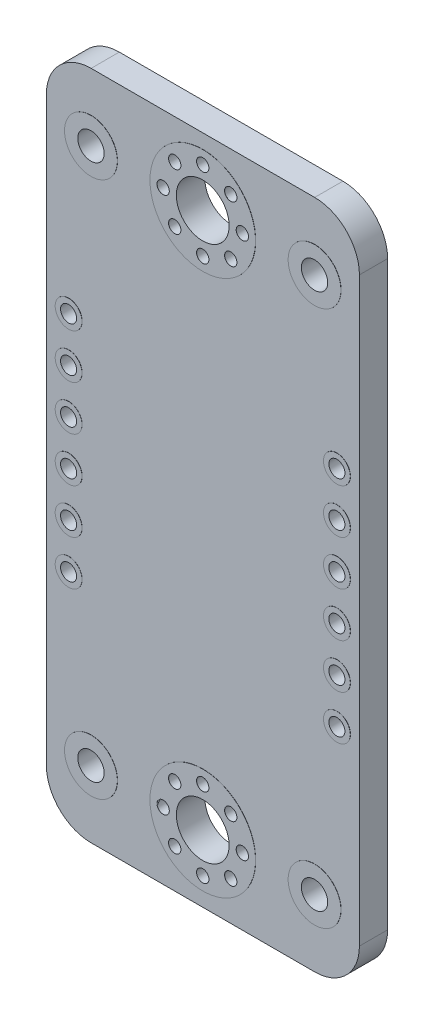
from build123d import *

# Parameters (mm, degrees)
MODEL_R             = 0.4572
MODEL_R_2           = 1.499997
MODEL_R_3           = 0.350012
MODEL_R_4           = 0.7500112
BOSS_EXTRUDE1_DEPTH = 1.6
SKETCH1_R           = 2.999994
SKETCH1_R_2         = 1.499997
SKETCH1_R_3         = 0.350012
SKETCH1_R_4         = 0.7500112
SKETCH1_R_5         = 0.762
SKETCH1_R_6         = 0.4572
BOSS_EXTRUDE2_DEPTH = 0.01
SKETCH2_W           = 1.25
SKETCH2_H           = 2
BOSS_EXTRUDE3_DEPTH = 0.3
BOSS_EXTRUDE4_START = 2.89
BOSS_EXTRUDE4_DEPTH = 1.25
LPATTERN1_COUNT     = 2
LPATTERN1_PITCH     = 10.75
LPATTERN1_2_COUNT   = 4
LPATTERN1_2_PITCH   = 6.66


with BuildPart() as part:
    # Model → Boss-Extrude1 (new body)
    with BuildSketch(Plane.XY):
        with BuildLine():
            Line((2.54, 0), (15.24, 0))
            ThreePointArc((15.24, 0), (17.036051224, -0.743948776), (17.78, -2.54))
            Line((17.78, -2.54), (17.78, -35.56))
            ThreePointArc((17.78, -35.56), (17.036051224, -37.356051224), (15.24, -38.1))
            Line((15.24, -38.1), (2.54, -38.1))
            ThreePointArc((2.54, -38.1), (0.743948776, -37.356051224), (0, -35.56))
            Line((0, -35.56), (0, -2.54))
            ThreePointArc((0, -2.54), (0.743948776, -0.743948776), (2.54, 0))
        make_face()
        with Locations((16.51, -15.24)):
            Circle(MODEL_R, mode=Mode.SUBTRACT)
        with Locations((16.51, -17.78)):
            Circle(MODEL_R, mode=Mode.SUBTRACT)
        with Locations((16.51, -20.32)):
            Circle(MODEL_R, mode=Mode.SUBTRACT)
        with Locations((16.51, -22.86)):
            Circle(MODEL_R, mode=Mode.SUBTRACT)
        with Locations((16.51, -25.4)):
            Circle(MODEL_R, mode=Mode.SUBTRACT)
        with Locations((1.27, -25.4)):
            Circle(MODEL_R, mode=Mode.SUBTRACT)
        with Locations((1.27, -22.86)):
            Circle(MODEL_R, mode=Mode.SUBTRACT)
        with Locations((1.27, -20.32)):
            Circle(MODEL_R, mode=Mode.SUBTRACT)
        with Locations((1.27, -17.78)):
            Circle(MODEL_R, mode=Mode.SUBTRACT)
        with Locations((1.27, -15.24)):
            Circle(MODEL_R, mode=Mode.SUBTRACT)
        with Locations((1.27, -12.7)):
            Circle(MODEL_R, mode=Mode.SUBTRACT)
        with Locations((8.89, -3.81)):
            Circle(MODEL_R_2, mode=Mode.SUBTRACT)
        with Locations((11.1400082, -3.81)):
            Circle(MODEL_R_3, mode=Mode.SUBTRACT)
        with Locations((6.6399918, -3.81)):
            Circle(MODEL_R_3, mode=Mode.SUBTRACT)
        with Locations((8.89, -1.560068)):
            Circle(MODEL_R_3, mode=Mode.SUBTRACT)
        with Locations((8.89, -6.059932)):
            Circle(MODEL_R_3, mode=Mode.SUBTRACT)
        with Locations((10.481056, -5.401056)):
            Circle(MODEL_R_3, mode=Mode.SUBTRACT)
        with Locations((10.481056, -2.218944)):
            Circle(MODEL_R_3, mode=Mode.SUBTRACT)
        with Locations((7.298944, -2.218944)):
            Circle(MODEL_R_3, mode=Mode.SUBTRACT)
        with Locations((7.298944, -5.401056)):
            Circle(MODEL_R_3, mode=Mode.SUBTRACT)
        with Locations((8.89, -34.29)):
            Circle(MODEL_R_2, mode=Mode.SUBTRACT)
        with Locations((11.1400082, -34.29)):
            Circle(MODEL_R_3, mode=Mode.SUBTRACT)
        with Locations((6.6399918, -34.29)):
            Circle(MODEL_R_3, mode=Mode.SUBTRACT)
        with Locations((8.89, -32.040068)):
            Circle(MODEL_R_3, mode=Mode.SUBTRACT)
        with Locations((8.89, -36.539932)):
            Circle(MODEL_R_3, mode=Mode.SUBTRACT)
        with Locations((10.481056, -35.881056)):
            Circle(MODEL_R_3, mode=Mode.SUBTRACT)
        with Locations((10.481056, -32.698944)):
            Circle(MODEL_R_3, mode=Mode.SUBTRACT)
        with Locations((7.298944, -32.698944)):
            Circle(MODEL_R_3, mode=Mode.SUBTRACT)
        with Locations((7.298944, -35.881056)):
            Circle(MODEL_R_3, mode=Mode.SUBTRACT)
        with Locations((2.54, -3.81)):
            Circle(MODEL_R_4, mode=Mode.SUBTRACT)
        with Locations((15.24, -3.81)):
            Circle(MODEL_R_4, mode=Mode.SUBTRACT)
        with Locations((15.24, -34.29)):
            Circle(MODEL_R_4, mode=Mode.SUBTRACT)
        with Locations((2.54, -34.29)):
            Circle(MODEL_R_4, mode=Mode.SUBTRACT)
        with Locations((16.51, -12.7)):
            Circle(MODEL_R, mode=Mode.SUBTRACT)
    extrude(amount=BOSS_EXTRUDE1_DEPTH)

    # Sketch1 → Boss-Extrude2 (add)
    # profile 1 of 18: a face of its own
    with BuildSketch(Plane.XY.offset(1.6)):
        with Locations(Location((8.89, -3.81, 0), (0, 0, 180))):
            Circle(SKETCH1_R)
        with Locations((8.89, -3.81)):
            Circle(SKETCH1_R_2, mode=Mode.SUBTRACT)
        with Locations((8.89, -1.560068)):
            Circle(SKETCH1_R_3, mode=Mode.SUBTRACT)
        with Locations(Location((10.480942174, -2.219218799, 0), (0, 0, 157.475654989))):
            Circle(SKETCH1_R_3, mode=Mode.SUBTRACT)
        with Locations(Location((11.139818174, -3.810274799, 0), (0, 0, 145.308530231))):
            Circle(SKETCH1_R_3, mode=Mode.SUBTRACT)
        with Locations(Location((10.480667375, -5.401216974, 0), (0, 0, 112.465570954))):
            Circle(SKETCH1_R_3, mode=Mode.SUBTRACT)
        with Locations(Location((8.889611375, -6.060092974, 0), (0, 0, 112.465570954))):
            Circle(SKETCH1_R_3, mode=Mode.SUBTRACT)
        with Locations(Location((7.298669201, -5.400942174, 0), (0, 0, 247.52434501))):
            Circle(SKETCH1_R_3, mode=Mode.SUBTRACT)
        with Locations(Location((6.639793201, -3.809886174, 0), (0, 0, 240.199902331))):
            Circle(SKETCH1_R_3, mode=Mode.SUBTRACT)
        with Locations((7.298944, -2.218944)):
            Circle(SKETCH1_R_3, mode=Mode.SUBTRACT)
    # profile 2 of 18: a face of its own
    with BuildSketch(Plane.XY.offset(1.6)):
        with Locations(Location((2.54, -3.81, 0), (0, 0, 180))):
            Circle(SKETCH1_R_2)
        with Locations((2.54, -3.81)):
            Circle(SKETCH1_R_4, mode=Mode.SUBTRACT)
    # profile 3 of 18: a face of its own
    with BuildSketch(Plane.XY.offset(1.6)):
        with Locations(Location((1.27, -20.32, 0), (0, 0, 180))):
            Circle(SKETCH1_R_5)
        with Locations((1.27, -20.32)):
            Circle(SKETCH1_R_6, mode=Mode.SUBTRACT)
    # profile 4 of 18: a face of its own
    with BuildSketch(Plane.XY.offset(1.6)):
        with Locations(Location((1.27, -22.86, 0), (0, 0, 180))):
            Circle(SKETCH1_R_5)
        with Locations((1.27, -22.86)):
            Circle(SKETCH1_R_6, mode=Mode.SUBTRACT)
    # profile 5 of 18: a face of its own
    with BuildSketch(Plane.XY.offset(1.6)):
        with Locations(Location((1.27, -25.4, 0), (0, 0, 180))):
            Circle(SKETCH1_R_5)
        with Locations((1.27, -25.4)):
            Circle(SKETCH1_R_6, mode=Mode.SUBTRACT)
    # profile 6 of 18: a face of its own
    with BuildSketch(Plane.XY.offset(1.6)):
        with Locations(Location((15.24, -3.81, 0), (0, 0, 180))):
            Circle(SKETCH1_R_2)
        with Locations((15.24, -3.81)):
            Circle(SKETCH1_R_4, mode=Mode.SUBTRACT)
    # profile 7 of 18: a face of its own
    with BuildSketch(Plane.XY.offset(1.6)):
        with Locations(Location((15.24, -34.29, 0), (0, 0, 180))):
            Circle(SKETCH1_R_2)
        with Locations(Location((15.24, -34.29, 0), (0, 0, 180))):
            Circle(SKETCH1_R_4, mode=Mode.SUBTRACT)
    # profile 8 of 18: a face of its own
    with BuildSketch(Plane.XY.offset(1.6)):
        with Locations(Location((2.54, -34.29, 0), (0, 0, 180))):
            Circle(SKETCH1_R_2)
        with Locations(Location((2.54, -34.29, 0), (0, 0, 180))):
            Circle(SKETCH1_R_4, mode=Mode.SUBTRACT)
    # profile 9 of 18: a face of its own
    with BuildSketch(Plane.XY.offset(1.6)):
        with Locations(Location((8.89, -34.29, 0), (0, 0, 180))):
            Circle(SKETCH1_R)
        with Locations(Location((7.298944, -35.881056, 0), (0, 0, 180))):
            Circle(SKETCH1_R_3, mode=Mode.SUBTRACT)
        with Locations(Location((6.639793201, -34.290113826, 0), (0, 0, 180))):
            Circle(SKETCH1_R_3, mode=Mode.SUBTRACT)
        with Locations(Location((7.298669201, -32.699057826, 0), (0, 0, 180))):
            Circle(SKETCH1_R_3, mode=Mode.SUBTRACT)
        with Locations(Location((8.889611375, -32.039907026, 0), (0, 0, 180))):
            Circle(SKETCH1_R_3, mode=Mode.SUBTRACT)
        with Locations(Location((10.480667375, -32.698783026, 0), (0, 0, 180))):
            Circle(SKETCH1_R_3, mode=Mode.SUBTRACT)
        with Locations(Location((11.139818174, -34.289725201, 0), (0, 0, 180))):
            Circle(SKETCH1_R_3, mode=Mode.SUBTRACT)
        with Locations(Location((10.480942174, -35.880781201, 0), (0, 0, 180))):
            Circle(SKETCH1_R_3, mode=Mode.SUBTRACT)
        with Locations(Location((8.89, -36.539932, 0), (0, 0, 180))):
            Circle(SKETCH1_R_3, mode=Mode.SUBTRACT)
        with Locations(Location((8.89, -34.29, 0), (0, 0, 180))):
            Circle(SKETCH1_R_2, mode=Mode.SUBTRACT)
    # profile 10 of 18: a face of its own
    with BuildSketch(Plane.XY.offset(1.6)):
        with Locations(Location((1.27, -12.7, 0), (0, 0, 180))):
            Circle(SKETCH1_R_5)
        with Locations(Location((1.27, -12.7, 0), (0, 0, 180))):
            Circle(SKETCH1_R_6, mode=Mode.SUBTRACT)
    # profile 11 of 18: a face of its own
    with BuildSketch(Plane.XY.offset(1.6)):
        with Locations(Location((1.27, -15.24, 0), (0, 0, 180))):
            Circle(SKETCH1_R_5)
        with Locations(Location((1.27, -15.24, 0), (0, 0, 180))):
            Circle(SKETCH1_R_6, mode=Mode.SUBTRACT)
    # profile 12 of 18: a face of its own
    with BuildSketch(Plane.XY.offset(1.6)):
        with Locations(Location((1.27, -17.78, 0), (0, 0, 180))):
            Circle(SKETCH1_R_5)
        with Locations(Location((1.27, -17.78, 0), (0, 0, 180))):
            Circle(SKETCH1_R_6, mode=Mode.SUBTRACT)
    # profile 13 of 18: a face of its own
    with BuildSketch(Plane.XY.offset(1.6)):
        with Locations(Location((16.51, -17.78, 0), (0, 0, 180))):
            Circle(SKETCH1_R_5)
        with Locations((16.51, -17.78)):
            Circle(SKETCH1_R_6, mode=Mode.SUBTRACT)
    # profile 14 of 18: a face of its own
    with BuildSketch(Plane.XY.offset(1.6)):
        with Locations(Location((16.51, -15.24, 0), (0, 0, 180))):
            Circle(SKETCH1_R_5)
        with Locations((16.51, -15.24)):
            Circle(SKETCH1_R_6, mode=Mode.SUBTRACT)
    # profile 15 of 18: a face of its own
    with BuildSketch(Plane.XY.offset(1.6)):
        with Locations(Location((16.51, -12.7, 0), (0, 0, 180))):
            Circle(SKETCH1_R_5)
        with Locations((16.51, -12.7)):
            Circle(SKETCH1_R_6, mode=Mode.SUBTRACT)
    # profile 16 of 18: a face of its own
    with BuildSketch(Plane.XY.offset(1.6)):
        with Locations(Location((16.51, -25.4, 0), (0, 0, 180))):
            Circle(SKETCH1_R_5)
        with Locations(Location((16.51, -25.4, 0), (0, 0, 180))):
            Circle(SKETCH1_R_6, mode=Mode.SUBTRACT)
    # profile 17 of 18: a face of its own
    with BuildSketch(Plane.XY.offset(1.6)):
        with Locations(Location((16.51, -22.86, 0), (0, 0, 180))):
            Circle(SKETCH1_R_5)
        with Locations(Location((16.51, -22.86, 0), (0, 0, 180))):
            Circle(SKETCH1_R_6, mode=Mode.SUBTRACT)
    # profile 18 of 18: a face of its own
    with BuildSketch(Plane.XY.offset(1.6)):
        with Locations(Location((16.51, -20.32, 0), (0, 0, 180))):
            Circle(SKETCH1_R_5)
        with Locations(Location((16.51, -20.32, 0), (0, 0, 180))):
            Circle(SKETCH1_R_6, mode=Mode.SUBTRACT)
    boss_extrude2 = extrude(amount=BOSS_EXTRUDE2_DEPTH)

    # Mirror1: Boss-Extrude2 across plane
    add(boss_extrude2.mirror(Plane.XY.offset(0.8)))

    # Sketch2 → Boss-Extrude3 (add)
    with BuildSketch(Plane(origin=(0, 0, 0), x_dir=(-1, 0, 0), z_dir=(0, 0, -1))):
        with Locations((-3.515, -9.05)):
            Rectangle(SKETCH2_W, SKETCH2_H)
        with Locations((-14.265, -9.05)):
            Rectangle(SKETCH2_W, SKETCH2_H)
        with Locations((-3.515, -15.716666667)):
            Rectangle(SKETCH2_W, SKETCH2_H)
        with Locations((-3.515, -22.383333333)):
            Rectangle(SKETCH2_W, SKETCH2_H)
        with Locations((-3.515, -29.05)):
            Rectangle(SKETCH2_W, SKETCH2_H)
        with Locations((-14.265, -15.716666667)):
            Rectangle(SKETCH2_W, SKETCH2_H)
        with Locations((-14.265, -22.383333333)):
            Rectangle(SKETCH2_W, SKETCH2_H)
        with Locations((-14.265, -29.05)):
            Rectangle(SKETCH2_W, SKETCH2_H)
    extrude(amount=BOSS_EXTRUDE3_DEPTH)


with BuildPart() as body_2:
    # Sketch3 → Boss-Extrude4 (new body)
    with BuildSketch(Plane(origin=(0, 0, 0), x_dir=(0, 0, -1), z_dir=(1, 0, 0)).offset(BOSS_EXTRUDE4_START)):
        Polygon((0.3, -8.35), (0.8, -8.45), (0.8, -9.65), (0.3, -9.75), align=None)
    extrude(amount=BOSS_EXTRUDE4_DEPTH)


with BuildPart() as lpattern1_1:
    # LPattern1: pattern copy
    add(body_2.part.moved(Location(Vector(1, 0, 0) * (1 * LPATTERN1_PITCH))))


with BuildPart() as lpattern1_2_1:
    # LPattern1 2: pattern copy
    add(body_2.part.moved(Location(Vector(0, -1, 0) * (1 * LPATTERN1_2_PITCH))))


with BuildPart() as lpattern1_2_2:
    # LPattern1 2: pattern copy
    add(body_2.part.moved(Location(Vector(0, -1, 0) * (2 * LPATTERN1_2_PITCH))))


with BuildPart() as lpattern1_2_3:
    # LPattern1 2: pattern copy
    add(body_2.part.moved(Location(Vector(0, -1, 0) * (3 * LPATTERN1_2_PITCH))))


with BuildPart() as lpattern1_2_4:
    # LPattern1 2: pattern copy
    add(lpattern1_1.part.moved(Location(Vector(0, -1, 0) * (1 * LPATTERN1_2_PITCH))))


with BuildPart() as lpattern1_2_5:
    # LPattern1 2: pattern copy
    add(lpattern1_1.part.moved(Location(Vector(0, -1, 0) * (2 * LPATTERN1_2_PITCH))))


with BuildPart() as lpattern1_2_6:
    # LPattern1 2: pattern copy
    add(lpattern1_1.part.moved(Location(Vector(0, -1, 0) * (3 * LPATTERN1_2_PITCH))))


solid = Compound([part.part, body_2.part, lpattern1_1.part, lpattern1_2_1.part, lpattern1_2_2.part, lpattern1_2_3.part, lpattern1_2_4.part, lpattern1_2_5.part, lpattern1_2_6.part])
